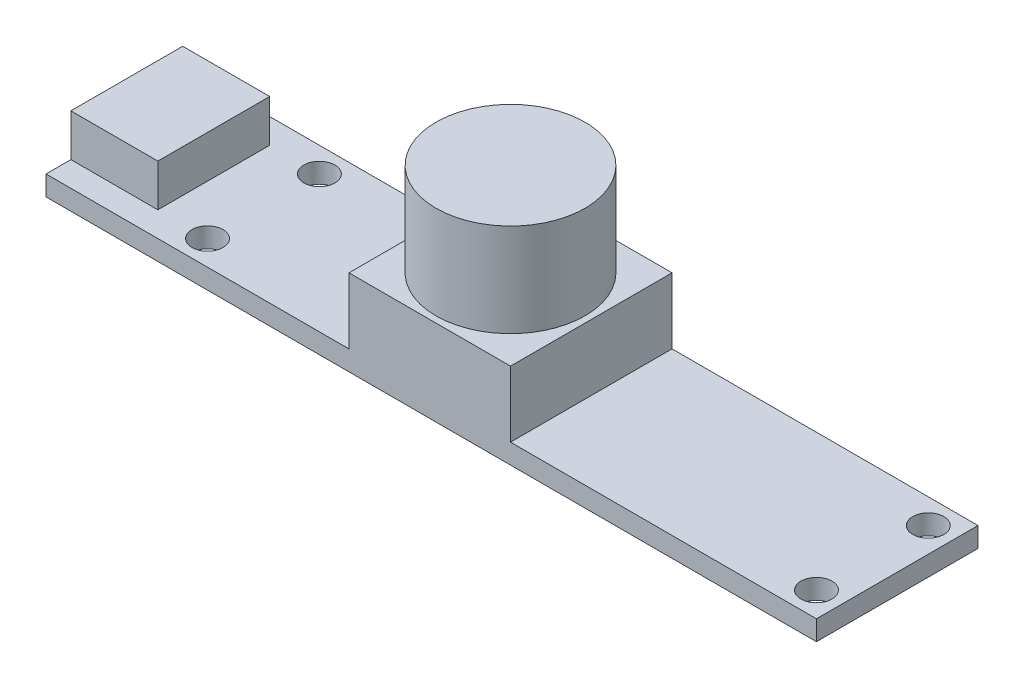
from build123d import *

# Parameters (mm, degrees)
SKETCH1_W             = 24.38
SKETCH1_H             = 13
SKETCH1_R             = 1.25
BOSS_EXTRUDE1_DEPTH   = 1.6
SKETCH1_W_2           = 24.62
BOSS_EXTRUDE1_2_DEPTH = 1.6
SKETCH1_3_W           = 13
SKETCH1_3_H           = 13
BOSS_EXTRUDE2_DEPTH   = 6.9
SKETCH1_4_R           = 6
BOSS_EXTRUDE3_DEPTH   = 14.4
SKETCH3_W             = 7
SKETCH3_H             = 9
BOSS_EXTRUDE4_DEPTH   = 3.4


with BuildPart() as part:
    # Sketch1 → Boss-Extrude1 (new body)
    with BuildSketch(Plane(origin=(0, 0, 0), x_dir=(1, 0, 0), z_dir=(0, 1, 0))):
        with Locations((12.19, 6.5)):
            Rectangle(SKETCH1_W, SKETCH1_H)
        with Locations((11, 2)):
            Circle(SKETCH1_R, mode=Mode.SUBTRACT)
        with Locations((11, 11)):
            Circle(SKETCH1_R, mode=Mode.SUBTRACT)
    extrude(amount=BOSS_EXTRUDE1_DEPTH)



with BuildPart() as body_2:
    # Sketch1 → Boss-Extrude1 2 (new body)
    with BuildSketch(Plane(origin=(0, 0, 0), x_dir=(1, 0, 0), z_dir=(0, 1, 0))):
        with Locations((49.69, 6.5)):
            Rectangle(SKETCH1_W_2, SKETCH1_H)
        with Locations((60, 2)):
            Circle(SKETCH1_R, mode=Mode.SUBTRACT)
        with Locations((60, 11)):
            Circle(SKETCH1_R, mode=Mode.SUBTRACT)
    extrude(amount=BOSS_EXTRUDE1_2_DEPTH)


with BuildPart() as part_1:
    add(part.part)

    add(body_2.part)  # Boss-Extrude2 merges body 2
    # Sketch1<3> → Boss-Extrude2 (add)
    with BuildSketch(Plane(origin=(0, 0, 0), x_dir=(1, 0, 0), z_dir=(0, 1, 0))):
        with Locations((30.88, 6.5)):
            Rectangle(SKETCH1_3_W, SKETCH1_3_H)
    extrude(amount=BOSS_EXTRUDE2_DEPTH)

    # Sketch1<4> → Boss-Extrude3 (add)
    with BuildSketch(Plane(origin=(0, 0, 0), x_dir=(1, 0, 0), z_dir=(0, 1, 0))):
        with Locations((30.88, 6.5)):
            Circle(SKETCH1_4_R)
    extrude(amount=BOSS_EXTRUDE3_DEPTH)

    # Sketch3 → Boss-Extrude4 (add)
    with BuildSketch(Plane(origin=(0, 1.6, 0), x_dir=(1, 0, 0), z_dir=(0, 1, 0))):
        with Locations((3.5, 6.5)):
            Rectangle(SKETCH3_W, SKETCH3_H)
    extrude(amount=BOSS_EXTRUDE4_DEPTH)


solid = part_1.part
